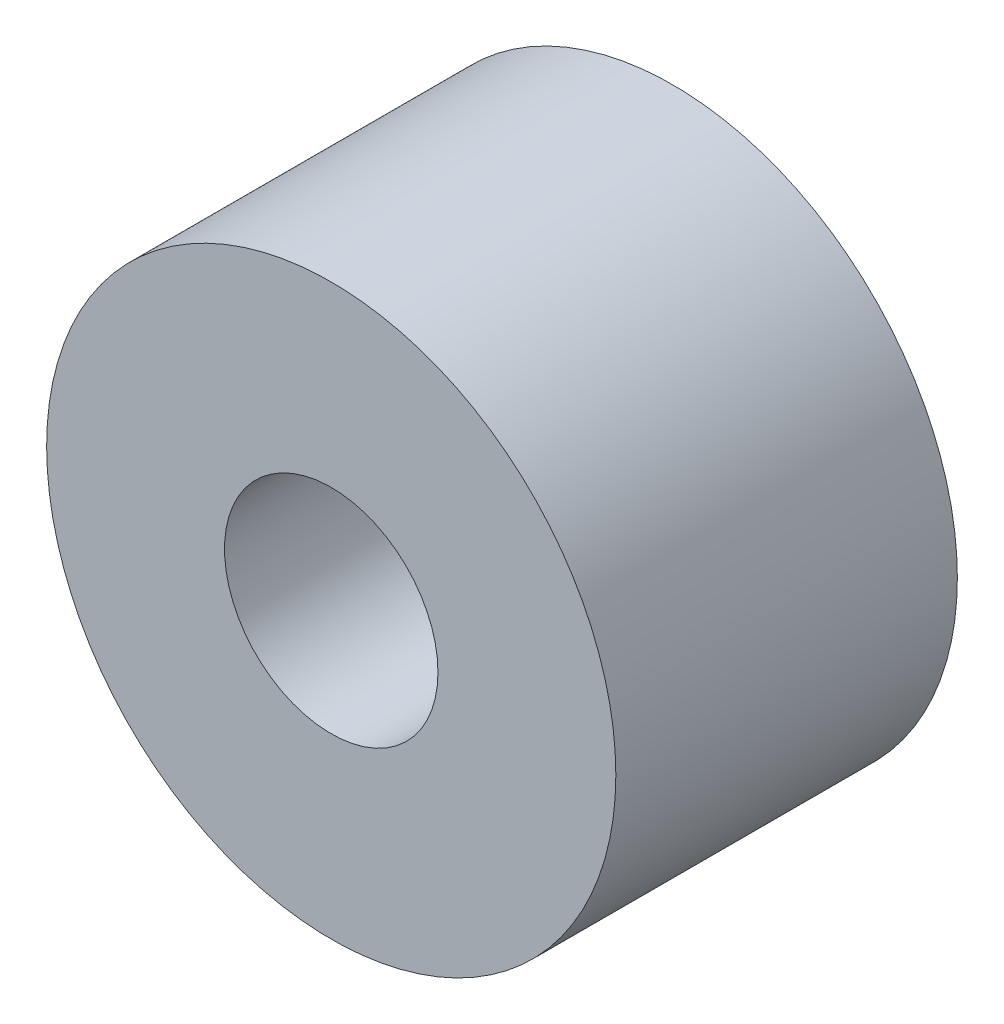
from build123d import *

# Parameters (mm, degrees)
SKETCH1_W = 7.9375
SKETCH1_H = 15.24


with BuildPart() as part:
    # Sketch1 → Revolve1 (revolve)
    with BuildSketch(Plane(origin=(0, 0, 0), x_dir=(1, 0, 0), z_dir=(0, 1, 0)), mode=Mode.PRIVATE) as revolve1_sk:
        with Locations((-8.73125, 7.62)):
            Rectangle(SKETCH1_W, SKETCH1_H)
    revolve(revolve1_sk.sketch.rotate(Axis((0, 0, 0), (0, 0, -1)), 180), axis=Axis((0, 0, 0), (0, 0, -1)))


solid = part.part
